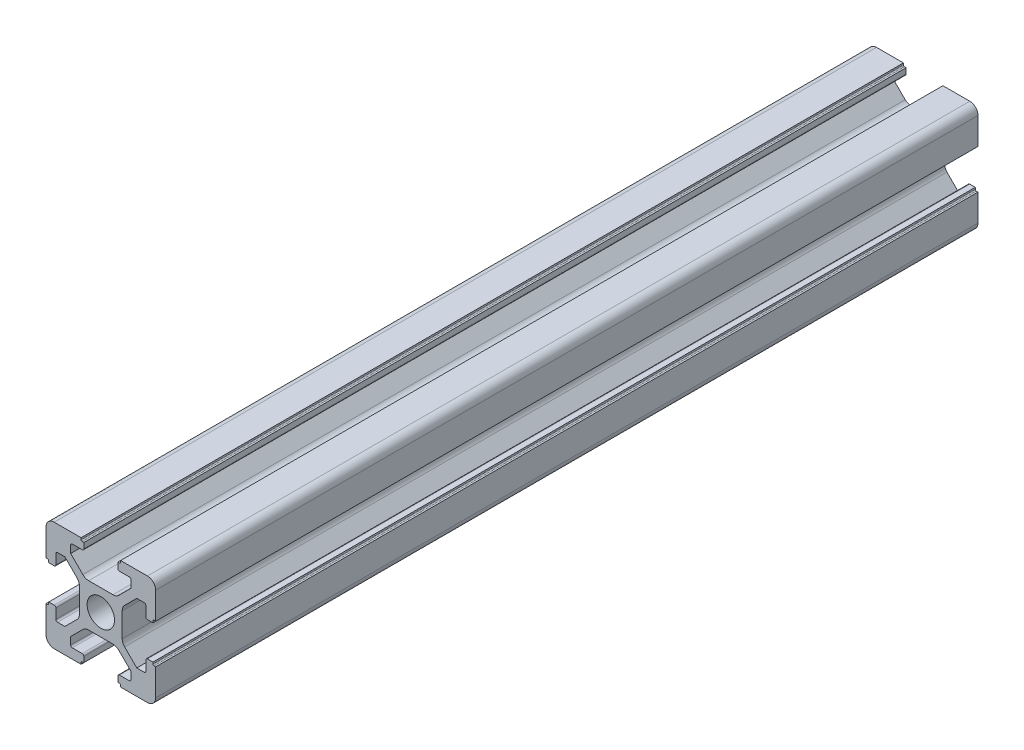
from build123d import *

# Parameters (mm, degrees)
SKETCH_1_R      = 2.5
EXTRUDE_1_DEPTH = 150


with BuildPart() as part:
    # 草图1 → 凸台-拉伸1 (new body)
    with BuildSketch(Plane.XY):
        with BuildLine():
            Line((4.215995631, 3.244230202), (6.436655803, 5.464890373))
            Line((6.436655803, 5.464890373), (7.776655803, 5.464890373))
            ThreePointArc((7.776655803, 5.464890373), (7.988787838, 5.377022408), (8.076655803, 5.164890373))
            Line((8.076655803, 5.164890373), (8.076655803, 3.364890373))
            ThreePointArc((8.076655803, 3.364890373), (8.164523769, 3.152758339), (8.376655803, 3.064890373))
            Line((8.376655803, 3.064890373), (9.376655803, 3.064890373))
            Line((9.376655803, 3.064890373), (9.376655803, 3.364890373))
            ThreePointArc((9.376655803, 3.364890373), (9.435234447, 3.50631173), (9.576655803, 3.564890373))
            Line((9.576655803, 3.564890373), (9.876655803, 3.564890373))
            Line((9.876655803, 3.564890373), (9.876655803, 8.464890373))
            ThreePointArc((9.876655803, 8.464890373), (9.437315975, 9.525550545), (8.376655803, 9.964890373))
            Line((8.376655803, 9.964890373), (3.476655803, 9.964890373))
            Line((3.476655803, 9.964890373), (3.476655803, 9.664890373))
            ThreePointArc((3.476655803, 9.664890373), (3.418077159, 9.523469017), (3.276655803, 9.464890373))
            Line((3.276655803, 9.464890373), (2.976655803, 9.464890373))
            Line((2.976655803, 9.464890373), (2.976655803, 8.464890373))
            ThreePointArc((2.976655803, 8.464890373), (3.064523769, 8.252758339), (3.276655803, 8.164890373))
            Line((3.276655803, 8.164890373), (5.076655803, 8.164890373))
            ThreePointArc((5.076655803, 8.164890373), (5.288787838, 8.077022408), (5.376655803, 7.864890373))
            Line((5.376655803, 7.864890373), (5.376655803, 6.524890373))
            Line((5.376655803, 6.524890373), (3.155995631, 4.304230202))
            ThreePointArc((3.155995631, 4.304230202), (2.669360608, 3.979071075), (2.09533546, 3.864890373))
            Line((2.09533546, 3.864890373), (-2.342023853, 3.864890373))
            ThreePointArc((-2.342023853, 3.864890373), (-2.916049002, 3.979071075), (-3.402684025, 4.304230202))
            Line((-3.402684025, 4.304230202), (-5.623344197, 6.524890373))
            Line((-5.623344197, 6.524890373), (-5.623344197, 7.864890373))
            ThreePointArc((-5.623344197, 7.864890373), (-5.535476231, 8.077022408), (-5.323344197, 8.164890373))
            Line((-5.323344197, 8.164890373), (-3.523344197, 8.164890373))
            ThreePointArc((-3.523344197, 8.164890373), (-3.311212162, 8.252758339), (-3.223344197, 8.464890373))
            Line((-3.223344197, 8.464890373), (-3.223344197, 9.464890373))
            Line((-3.223344197, 9.464890373), (-3.523344197, 9.464890373))
            ThreePointArc((-3.523344197, 9.464890373), (-3.664765553, 9.523469017), (-3.723344197, 9.664890373))
            Line((-3.723344197, 9.664890373), (-3.723344197, 9.964890373))
            Line((-3.723344197, 9.964890373), (-8.623344197, 9.964890373))
            ThreePointArc((-8.623344197, 9.964890373), (-9.684004369, 9.525550545), (-10.123344197, 8.464890373))
            Line((-10.123344197, 8.464890373), (-10.123344197, 3.564890373))
            Line((-10.123344197, 3.564890373), (-9.823344197, 3.564890373))
            ThreePointArc((-9.823344197, 3.564890373), (-9.681922841, 3.50631173), (-9.623344197, 3.364890373))
            Line((-9.623344197, 3.364890373), (-9.623344197, 3.064890373))
            Line((-9.623344197, 3.064890373), (-8.623344197, 3.064890373))
            ThreePointArc((-8.623344197, 3.064890373), (-8.411212162, 3.152758339), (-8.323344197, 3.364890373))
            Line((-8.323344197, 3.364890373), (-8.323344197, 5.164890373))
            ThreePointArc((-8.323344197, 5.164890373), (-8.235476231, 5.377022408), (-8.023344197, 5.464890373))
            Line((-8.023344197, 5.464890373), (-6.683344197, 5.464890373))
            Line((-6.683344197, 5.464890373), (-4.462684025, 3.244230202))
            ThreePointArc((-4.462684025, 3.244230202), (-4.137524898, 2.757595178), (-4.023344197, 2.18357003))
            Line((-4.023344197, 2.18357003), (-4.023344197, -2.253789283))
            ThreePointArc((-4.023344197, -2.253789283), (-4.137524898, -2.827814432), (-4.462684025, -3.314449455))
            Line((-4.462684025, -3.314449455), (-6.683344197, -5.535109627))
            Line((-6.683344197, -5.535109627), (-8.023344197, -5.535109627))
            ThreePointArc((-8.023344197, -5.535109627), (-8.235476231, -5.447241661), (-8.323344197, -5.235109627))
            Line((-8.323344197, -5.235109627), (-8.323344197, -3.435109627))
            ThreePointArc((-8.323344197, -3.435109627), (-8.411212162, -3.222977592), (-8.623344197, -3.135109627))
            Line((-8.623344197, -3.135109627), (-9.623344197, -3.135109627))
            Line((-9.623344197, -3.135109627), (-9.623344197, -3.435109627))
            ThreePointArc((-9.623344197, -3.435109627), (-9.681922841, -3.576530983), (-9.823344197, -3.635109627))
            Line((-9.823344197, -3.635109627), (-10.123344197, -3.635109627))
            Line((-10.123344197, -3.635109627), (-10.123344197, -8.535109627))
            ThreePointArc((-10.123344197, -8.535109627), (-9.684004369, -9.595769798), (-8.623344197, -10.035109627))
            Line((-8.623344197, -10.035109627), (-3.723344197, -10.035109627))
            Line((-3.723344197, -10.035109627), (-3.723344197, -9.735109627))
            ThreePointArc((-3.723344197, -9.735109627), (-3.664765553, -9.59368827), (-3.523344197, -9.535109627))
            Line((-3.523344197, -9.535109627), (-3.223344197, -9.535109627))
            Line((-3.223344197, -9.535109627), (-3.223344197, -8.535109627))
            ThreePointArc((-3.223344197, -8.535109627), (-3.311212162, -8.322977592), (-3.523344197, -8.235109627))
            Line((-3.523344197, -8.235109627), (-5.323344197, -8.235109627))
            ThreePointArc((-5.323344197, -8.235109627), (-5.535476231, -8.147241661), (-5.623344197, -7.935109627))
            Line((-5.623344197, -7.935109627), (-5.623344197, -6.595109627))
            Line((-5.623344197, -6.595109627), (-3.402684025, -4.374449455))
            ThreePointArc((-3.402684025, -4.374449455), (-2.916049002, -4.049290328), (-2.342023853, -3.935109627))
            Line((-2.342023853, -3.935109627), (2.09533546, -3.935109627))
            ThreePointArc((2.09533546, -3.935109627), (2.669360608, -4.049290328), (3.155995631, -4.374449455))
            Line((3.155995631, -4.374449455), (5.376655803, -6.595109627))
            Line((5.376655803, -6.595109627), (5.376655803, -7.935109627))
            ThreePointArc((5.376655803, -7.935109627), (5.288787838, -8.147241661), (5.076655803, -8.235109627))
            Line((5.076655803, -8.235109627), (3.276655803, -8.235109627))
            ThreePointArc((3.276655803, -8.235109627), (3.064523769, -8.322977592), (2.976655803, -8.535109627))
            Line((2.976655803, -8.535109627), (2.976655803, -9.535109627))
            Line((2.976655803, -9.535109627), (3.276655803, -9.535109627))
            ThreePointArc((3.276655803, -9.535109627), (3.418077159, -9.59368827), (3.476655803, -9.735109627))
            Line((3.476655803, -9.735109627), (3.476655803, -10.035109627))
            Line((3.476655803, -10.035109627), (8.376655803, -10.035109627))
            ThreePointArc((8.376655803, -10.035109627), (9.437315975, -9.595769798), (9.876655803, -8.535109627))
            Line((9.876655803, -8.535109627), (9.876655803, -3.635109627))
            Line((9.876655803, -3.635109627), (9.576655803, -3.635109627))
            ThreePointArc((9.576655803, -3.635109627), (9.435234447, -3.576530983), (9.376655803, -3.435109627))
            Line((9.376655803, -3.435109627), (9.376655803, -3.135109627))
            Line((9.376655803, -3.135109627), (8.376655803, -3.135109627))
            ThreePointArc((8.376655803, -3.135109627), (8.164523769, -3.222977592), (8.076655803, -3.435109627))
            Line((8.076655803, -3.435109627), (8.076655803, -5.235109627))
            ThreePointArc((8.076655803, -5.235109627), (7.988787838, -5.447241661), (7.776655803, -5.535109627))
            Line((7.776655803, -5.535109627), (6.436655803, -5.535109627))
            Line((6.436655803, -5.535109627), (4.215995631, -3.314449455))
            ThreePointArc((4.215995631, -3.314449455), (3.890836504, -2.827814432), (3.776655803, -2.253789283))
            Line((3.776655803, -2.253789283), (3.776655803, 2.18357003))
            ThreePointArc((3.776655803, 2.18357003), (3.890836504, 2.757595178), (4.215995631, 3.244230202))
        make_face()
        with Locations((-0.123344197, -0.035109627)):
            Circle(SKETCH_1_R, mode=Mode.SUBTRACT)
    extrude(amount=EXTRUDE_1_DEPTH)


solid = part.part
